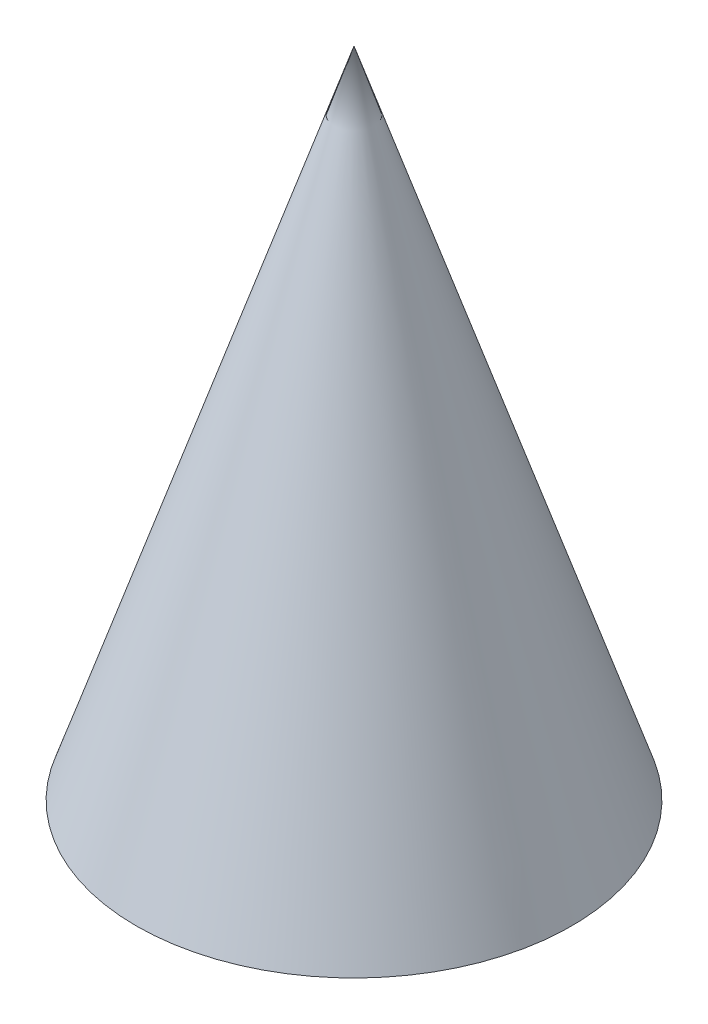
from build123d import *


with BuildPart() as part:
    # 草图1 → 旋转1 (revolve)
    with BuildSketch(Plane.XY, mode=Mode.PRIVATE) as revolve_1_sk:
        Polygon((0, 0), (25, 0), (0, 75), align=None)
    revolve(revolve_1_sk.sketch.rotate(Axis((0, 0, 0), (0, 1, 0)), 90), axis=Axis((0, 0, 0), (0, 1, 0)))


solid = part.part
